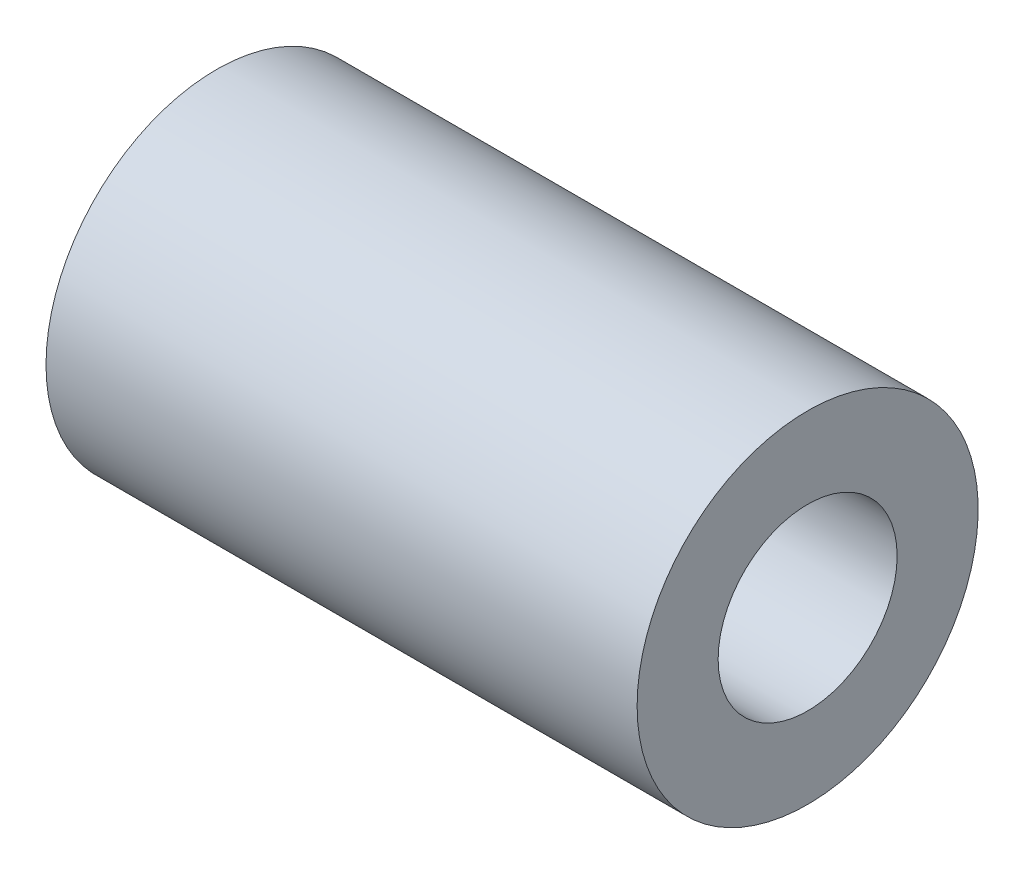
from build123d import *

# Parameters (mm, degrees)
SKETCH1_R           = 15
SKETCH1_R_2         = 7.874
BOSS_EXTRUDE1_DEPTH = 52


with BuildPart() as part:
    # Sketch1 → Boss-Extrude1 (new body)
    with BuildSketch(Plane(origin=(0, 0, 0), x_dir=(0, 0, -1), z_dir=(1, 0, 0))):
        with Locations(Location((0, 0, 0), (0, 0, 180))):
            Circle(SKETCH1_R)
        with Locations(Location((0, 0, 0), (0, 0, 180))):
            Circle(SKETCH1_R_2, mode=Mode.SUBTRACT)
    extrude(amount=BOSS_EXTRUDE1_DEPTH)


solid = part.part
